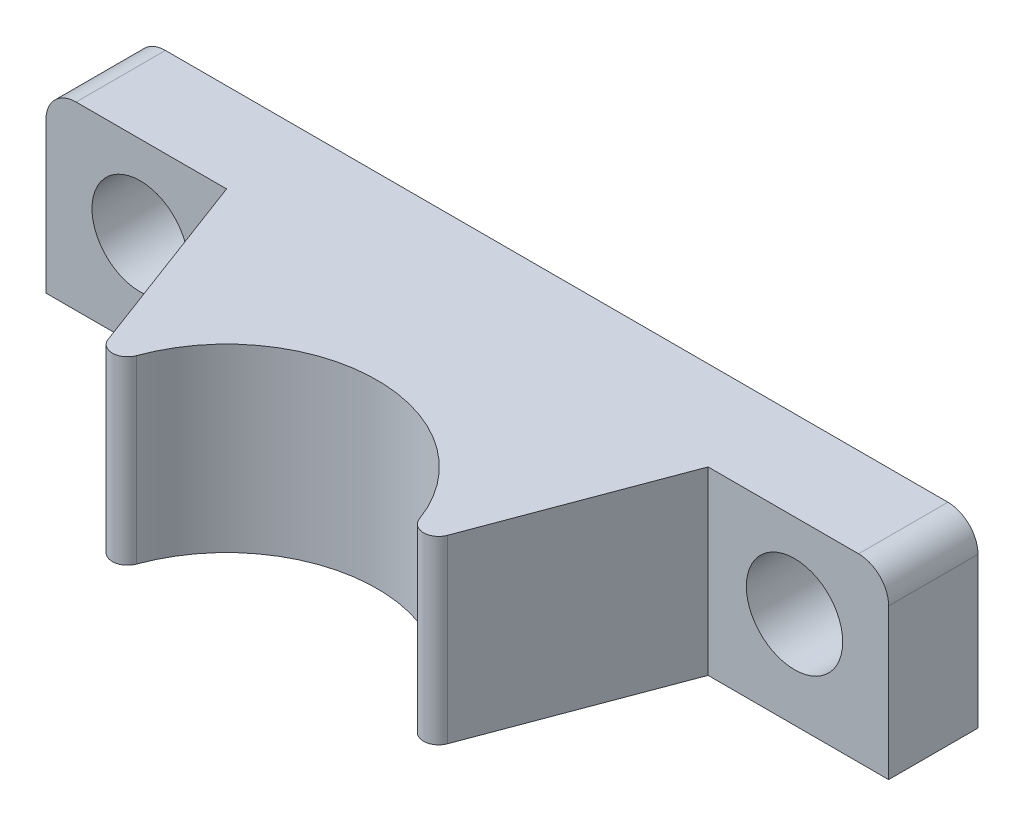
from build123d import *

# Parameters (mm, degrees)
BOSS_EXTRUDE1_DEPTH = 6
FILLET1_R           = 1
FILLET2_R           = 0.5
SKETCH2_R           = 1.6
CUT_EXTRUDE2_DEPTH  = 10


with BuildPart() as part:
    # Sketch1 → Boss-Extrude1 (new body)
    with BuildSketch(Plane(origin=(0, 41.463460463, 0), x_dir=(1, 0, 0), z_dir=(0, 1, 0))):
        with BuildLine():
            Line((26.614370899, -46.171636097), (23.614370899, -38.171636097))
            Line((23.614370899, -38.171636097), (17.614370899, -38.171636097))
            Line((17.614370899, -38.171636097), (17.614370899, -35.202564725))
            Line((17.614370899, -35.202564725), (45.614370899, -35.202564725))
            Line((45.614370899, -35.202564725), (45.614370899, -38.171636097))
            Line((45.614370899, -38.171636097), (39.614370899, -38.171636097))
            Line((39.614370899, -38.171636097), (36.614370899, -46.171636097))
            ThreePointArc((36.614370899, -46.171636097), (31.614370899, -41.171636097), (26.614370899, -46.171636097))
        make_face()
    extrude(amount=-BOSS_EXTRUDE1_DEPTH)

    # Fillet1
    fillet1_edges = [part.edges().sort_by_distance(p)[0] for p in [
        (17.614370899, 41.463460463, 36.687100411),
        (45.614370899, 41.463460463, 36.687100411),
    ]]
    fillet(fillet1_edges, radius=FILLET1_R)

    # Fillet2
    fillet2_edges = [part.edges().sort_by_distance(p)[0] for p in [
        (36.614370899, 38.463460463, 46.171636097),
        (26.614370899, 38.463460463, 46.171636097),
    ]]
    fillet(fillet2_edges, radius=FILLET2_R)

    # Sketch2 → Cut-Extrude2 (cut)
    with BuildSketch(Plane(origin=(0, 0, 35.202564725), x_dir=(-1, 0, 0), z_dir=(0, 0, -1))):
        with Locations((-20.74213752, 38.663460463)):
            Circle(SKETCH2_R)
        with Locations((-42.486604277, 38.663460463)):
            Circle(SKETCH2_R)
    extrude(amount=-CUT_EXTRUDE2_DEPTH, mode=Mode.SUBTRACT)


solid = part.part
